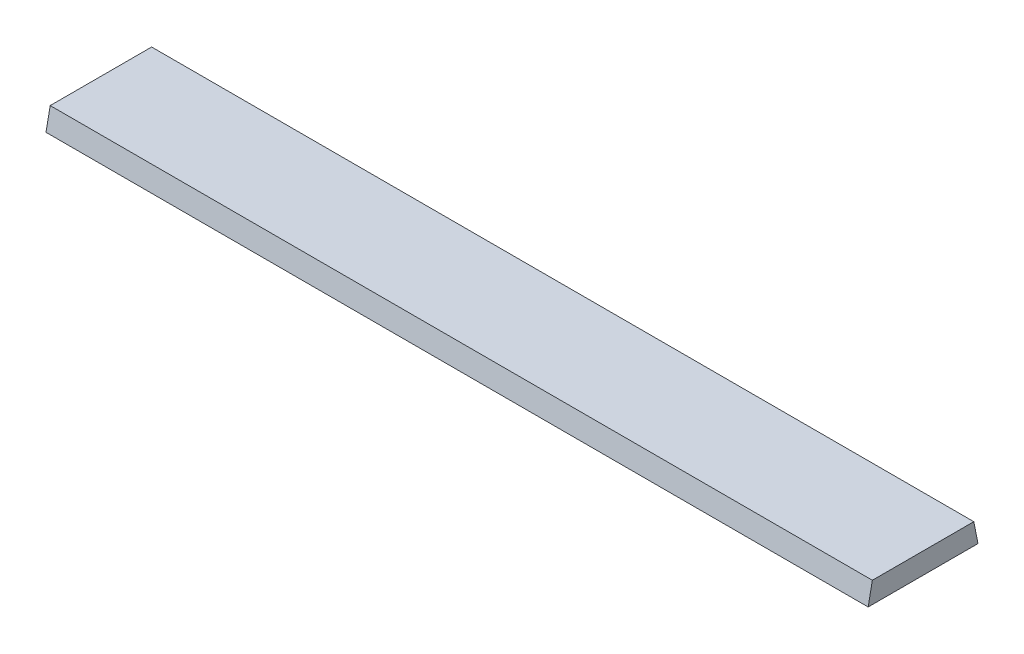
from build123d import *

# Parameters (mm, degrees)
CUT_TO_LENGTH_DEPTH = 742.95


with BuildPart() as part:
    # Sketch1 → Cut To Length (new body)
    with BuildSketch(Plane(origin=(0, 0, 0), x_dir=(0, 0, -1), z_dir=(1, 0, 0))):
        Polygon((49.625751756, 0), (-49.625751756, 0), (-45.836471158, 19.05), (45.836471158, 19.05), align=None)
    extrude(amount=CUT_TO_LENGTH_DEPTH)


solid = part.part
